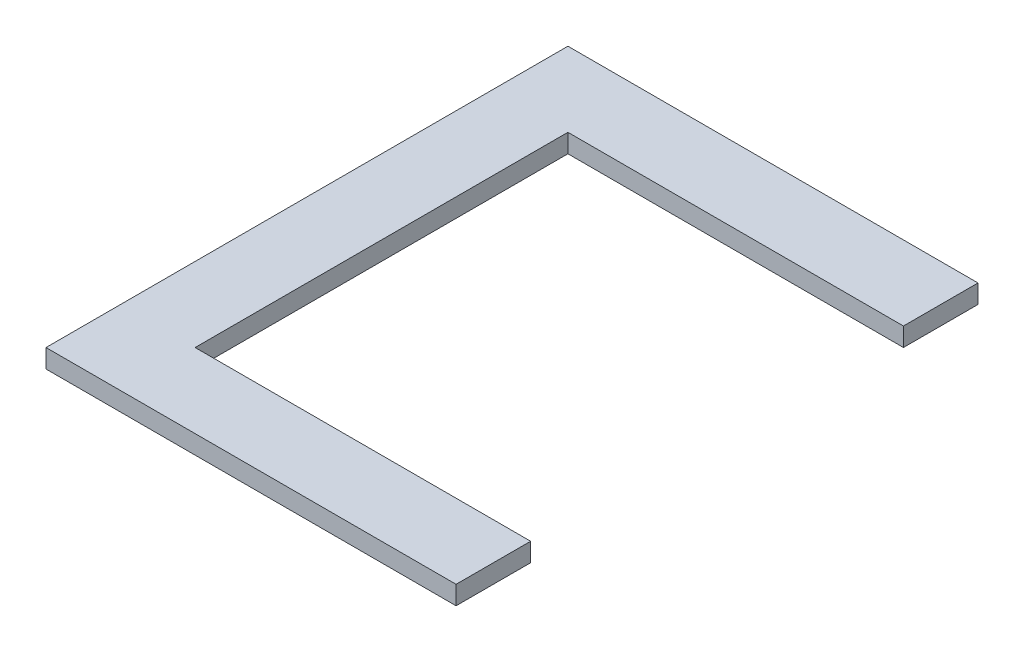
from build123d import *

# Parameters (mm, degrees)
BOSS_EXTRUDE1_DEPTH = 3.175


with BuildPart() as part:
    # Sketch1 → Boss-Extrude1 (new body)
    with BuildSketch(Plane(origin=(0, 0, 0), x_dir=(1, 0, 0), z_dir=(0, 1, 0))):
        Polygon((63.5, 31.75), (63.5, 44.45), (-6.35, 44.45), (-6.35, -44.45), (63.5, -44.45), (63.5, -31.75), (6.35, -31.75), (6.35, 31.75), align=None)
    extrude(amount=BOSS_EXTRUDE1_DEPTH)


solid = part.part
